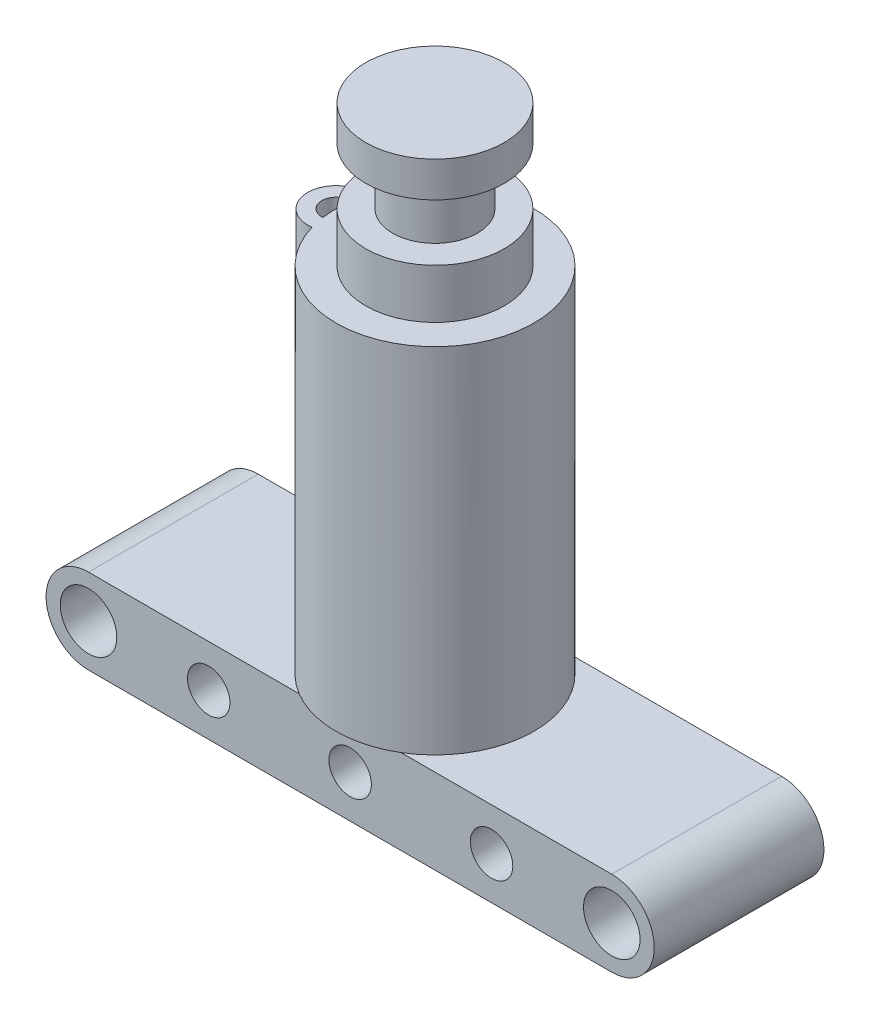
from build123d import *

# Parameters (mm, degrees)
SKETCH_1_R                 = 2
EXTRUDE_1_DEPTH            = 12
SKETCH_2_R                 = 1.5
CUT_EXTRUDE_1_DEPTH        = 42.868842831
PATTERN_LINEAR_1_COUNT     = 2
PATTERN_LINEAR_1_PITCH     = 10
PATTERN_LINEAR_1_COL_COUNT = 2
PATTERN_LINEAR_1_COL_PITCH = 10
SKETCH_4_R                 = 7
EXTRUDE_2_DEPTH            = 25
SKETCH_7_R                 = 2
SKETCH_7_R_2               = 1
EXTRUDE_3_DEPTH            = 4
EXTRUDE_5_DEPTH            = 2
SKETCH_10_R                = 4.9
EXTRUDE_6_DEPTH            = 10
CUT_EXTRUDE_START          = -4
SKETCH_13_R                = 4.9
SKETCH_13_R_2              = 3
CUT_EXTRUDE_2_DEPTH        = 4


with BuildPart() as part:
    # 草图1 → 凸台-拉伸1 (new body)
    with BuildSketch(Plane.XY):
        with BuildLine():
            Line((0, 3), (37, 3))
            ThreePointArc((37, 3), (40, 0), (37, -3))
            Line((37, -3), (0, -3))
            ThreePointArc((0, -3), (-3, 0), (0, 3))
        make_face()
        Circle(SKETCH_1_R, mode=Mode.SUBTRACT)
        with Locations((37, 0)):
            Circle(SKETCH_1_R, mode=Mode.SUBTRACT)
    extrude(amount=EXTRUDE_1_DEPTH)

    # 草图2 → 切除-拉伸1 (cut, through all)
    with BuildSketch(Plane.XY.offset(12)):
        with Locations((18.5, 0)):
            Circle(SKETCH_2_R)
    cut_extrude_1 = extrude(amount=-CUT_EXTRUDE_1_DEPTH, mode=Mode.SUBTRACT)

    # 阵列(线性)1: 切除-拉伸1 ×2
    with Locations(*[(-i * PATTERN_LINEAR_1_PITCH, 0, 0) for i in range(1, PATTERN_LINEAR_1_COUNT)]):
        add(cut_extrude_1, mode=Mode.SUBTRACT)

    # 阵列(线性)1 col: 切除-拉伸1 ×2
    with Locations(*[(i * PATTERN_LINEAR_1_COL_PITCH, 0, 0) for i in range(1, PATTERN_LINEAR_1_COL_COUNT)]):
        add(cut_extrude_1, mode=Mode.SUBTRACT)

    # 草图4 → 凸台-拉伸2 (add)
    with BuildSketch(Plane(origin=(0, 3, 0), x_dir=(1, 0, 0), z_dir=(0, 1, 0))):
        with Locations(Location((18.5, -6, 0), (0, 0, 58.997280866))):
            Circle(SKETCH_4_R)
    extrude(amount=EXTRUDE_2_DEPTH)

    # 草图7 → 凸台-拉伸3 (add)
    with BuildSketch(Plane(origin=(0, 28, 0), x_dir=(1, 0, 0), z_dir=(0, 1, 0))):
        with Locations((11.5, -6)):
            Circle(SKETCH_7_R)
        with Locations((11.5, -6)):
            Circle(SKETCH_7_R_2, mode=Mode.SUBTRACT)
    extrude(amount=-EXTRUDE_3_DEPTH)

    # 草图9 → 凸台-拉伸5 (add, symmetric)
    with BuildSketch(Plane(origin=(0, 14, 0), x_dir=(-1, 0, 0), z_dir=(0, -1, 0))):
        with BuildLine():
            ThreePointArc((-11.785714286, -7.979486637), (-11.66092193, -7.492317377), (-11.571428571, -6.997445717))
            ThreePointArc((-11.571428571, -6.997445717), (-10.5, -6), (-11.571428571, -5.002554283))
            ThreePointArc((-11.571428571, -5.002554283), (-11.66092193, -4.507682623), (-11.785714286, -4.020513363))
            ThreePointArc((-11.785714286, -4.020513363), (-9.5, -6), (-11.785714286, -7.979486637))
        make_face()
    extrude(amount=EXTRUDE_5_DEPTH, both=True)

    # 草图10 → 凸台-拉伸6 (add)
    with BuildSketch(Plane(origin=(0, 28, 0), x_dir=(1, 0, 0), z_dir=(0, 1, 0))):
        with Locations(Location((18.5, -6, 0), (0, 0, 270))):
            Circle(SKETCH_10_R)
    extrude(amount=EXTRUDE_6_DEPTH)

    # 草图13 → 切除-拉伸2 (cut)
    with BuildSketch(Plane(origin=(0, 35.5, 0), x_dir=(1, 0, 0), z_dir=(0, 1, 0)).offset(CUT_EXTRUDE_START)):
        with Locations(Location((18.5, -6, 0), (0, 0, 270))):
            Circle(SKETCH_13_R)
        with Locations(Location((18.5, -6, 0), (0, 0, 270))):
            Circle(SKETCH_13_R_2, mode=Mode.SUBTRACT)
    extrude(amount=CUT_EXTRUDE_2_DEPTH, mode=Mode.SUBTRACT)


solid = part.part
